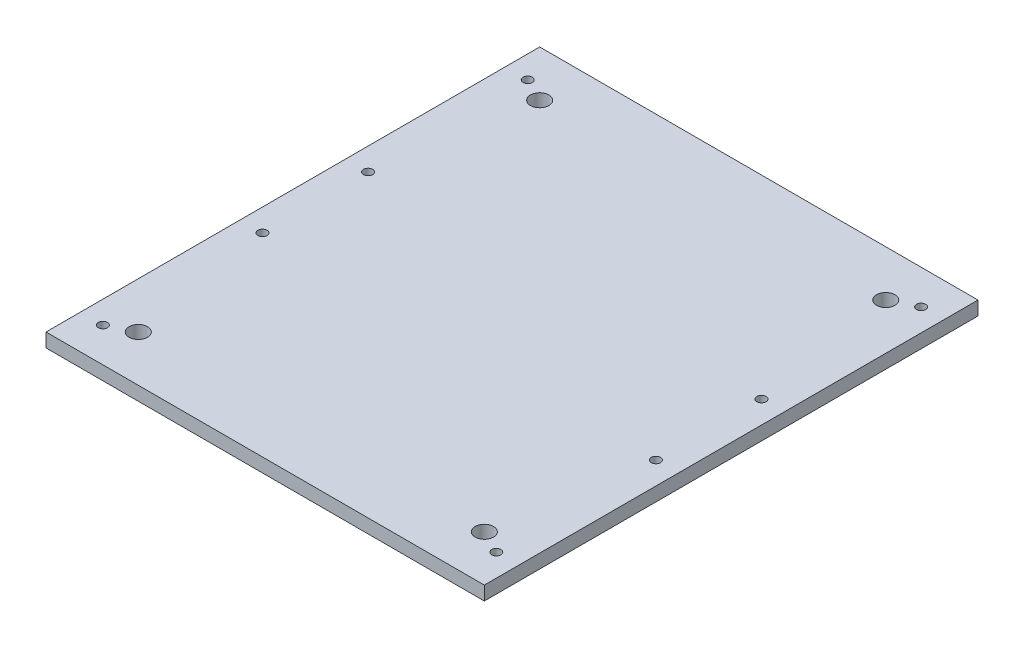
from build123d import *

# Parameters (mm, degrees)
SKETCH2_R                                  = 2
BOSS_EXTRUDE1_DEPTH                        = 3
SKETCH7_R                                  = 1
CUT_EXTRUDE2_DEPTH                         = 10
MIRROR3_COPY_1_SKETCH_R                    = 1
MIRROR3_COPY_1_DEPTH                       = 10
MIRROR3_AT_THE_SECOND_PLANE_COPY_1_SKETC_R = 1
MIRROR3_AT_THE_SECOND_PLANE_COPY_1_DEPTH   = 10
MIRROR3_AT_THE_SECOND_PLANE_COPY_2_SKETC_R = 1
MIRROR3_AT_THE_SECOND_PLANE_COPY_2_DEPTH   = 10
MIRROR3_AT_THE_SECOND_PLANE_COPY_3_SKETC_R = 1
MIRROR3_AT_THE_SECOND_PLANE_COPY_3_DEPTH   = 10


with BuildPart() as part:
    # Sketch2 → Boss-Extrude1 (new body)
    # profile 1 of 2: a face of its own
    with BuildSketch(Plane(origin=(0, 0, 0), x_dir=(1, 0, 0), z_dir=(0, 1, 0))):
        with BuildLine():
            ThreePointArc((37.5, -45.5), (36.085786438, -42.085786438), (39.5, -43.5))
            Line((39.5, -43.5), (47.5, -43.5))
            Line((47.5, -43.5), (47.5, 53.5))
            Line((47.5, 53.5), (-47.5, 53.5))
            Line((-47.5, 53.5), (-47.5, -53.5))
            Line((-47.5, -53.5), (37.5, -53.5))
            Line((37.5, -53.5), (37.5, -45.5))
        make_face()
        with Locations(Location((-37.5, -43.5, 0), (0, 0, 270))):
            Circle(SKETCH2_R, mode=Mode.SUBTRACT)
        with Locations(Location((-37.5, 43.5, 0), (0, 0, 270))):
            Circle(SKETCH2_R, mode=Mode.SUBTRACT)
        with Locations(Location((37.5, 43.5, 0), (0, 0, 270))):
            Circle(SKETCH2_R, mode=Mode.SUBTRACT)
    # profile 2 of 2: a face of its own
    with BuildSketch(Plane(origin=(0, 0, 0), x_dir=(1, 0, 0), z_dir=(0, 1, 0))):
        with BuildLine():
            Line((47.5, -43.5), (39.5, -43.5))
            ThreePointArc((39.5, -43.5), (38.914213562, -44.914213562), (37.5, -45.5))
            Line((37.5, -45.5), (37.5, -53.5))
            Line((37.5, -53.5), (47.5, -53.5))
            Line((47.5, -53.5), (47.5, -43.5))
        make_face()
    extrude(amount=BOSS_EXTRUDE1_DEPTH)

    # Sketch7 → Cut-Extrude2 (cut)
    with BuildSketch(Plane(origin=(0, 3, 0), x_dir=(1, 0, 0), z_dir=(0, 1, 0))):
        with Locations(Location((42.63, 46.04, 0), (0, 0, 270))):
            Circle(SKETCH7_R)
    cut_extrude2 = extrude(amount=-CUT_EXTRUDE2_DEPTH, mode=Mode.SUBTRACT)

    # Mirror2: Cut-Extrude2 across plane
    add(cut_extrude2.mirror(Plane(origin=(0, 0, -28.738611276), x_dir=(1, 0, 0), z_dir=(0, 0, -1))), mode=Mode.SUBTRACT)

    # Mirror3: Cut-Extrude2 across plane
    add(cut_extrude2.mirror(Plane(origin=(0, 0, 0), x_dir=(0, 0, 1), z_dir=(1, 0, 0))), mode=Mode.SUBTRACT)

    # Mirror3 copy 1 sketch → Mirror3 copy 1 (cut)
    with BuildSketch(Plane(origin=(0, 3, -57.477222552), x_dir=(-1, 0, 0), z_dir=(0, 1, 0))):
        with Locations(Location((42.63, 46.04, 0), (0, 0, 270))):
            Circle(MIRROR3_COPY_1_SKETCH_R)
    extrude(amount=-MIRROR3_COPY_1_DEPTH, mode=Mode.SUBTRACT)

    # Mirror3 at the second plane: Cut-Extrude2 across plane
    add(cut_extrude2.mirror(Plane.XY), mode=Mode.SUBTRACT)

    # Mirror3 at the second plane copy 1 sketc → Mirror3 at the second plane copy 1 (cut)
    with BuildSketch(Plane(origin=(0, 3, 57.477222552), x_dir=(1, 0, 0), z_dir=(0, 1, 0))):
        with Locations(Location((42.63, 46.04, 0), (0, 0, 270))):
            Circle(MIRROR3_AT_THE_SECOND_PLANE_COPY_1_SKETC_R)
    extrude(amount=-MIRROR3_AT_THE_SECOND_PLANE_COPY_1_DEPTH, mode=Mode.SUBTRACT)

    # Mirror3 at the second plane copy 2 sketc → Mirror3 at the second plane copy 2 (cut)
    with BuildSketch(Plane(origin=(0, 3, 0), x_dir=(-1, 0, 0), z_dir=(0, 1, 0))):
        with Locations(Location((42.63, 46.04, 0), (0, 0, 270))):
            Circle(MIRROR3_AT_THE_SECOND_PLANE_COPY_2_SKETC_R)
    extrude(amount=-MIRROR3_AT_THE_SECOND_PLANE_COPY_2_DEPTH, mode=Mode.SUBTRACT)

    # Mirror3 at the second plane copy 3 sketc → Mirror3 at the second plane copy 3 (cut)
    with BuildSketch(Plane(origin=(0, 3, 57.477222552), x_dir=(-1, 0, 0), z_dir=(0, 1, 0))):
        with Locations((42.63, -46.04)):
            Circle(MIRROR3_AT_THE_SECOND_PLANE_COPY_3_SKETC_R)
    extrude(amount=-MIRROR3_AT_THE_SECOND_PLANE_COPY_3_DEPTH, mode=Mode.SUBTRACT)


solid = part.part
